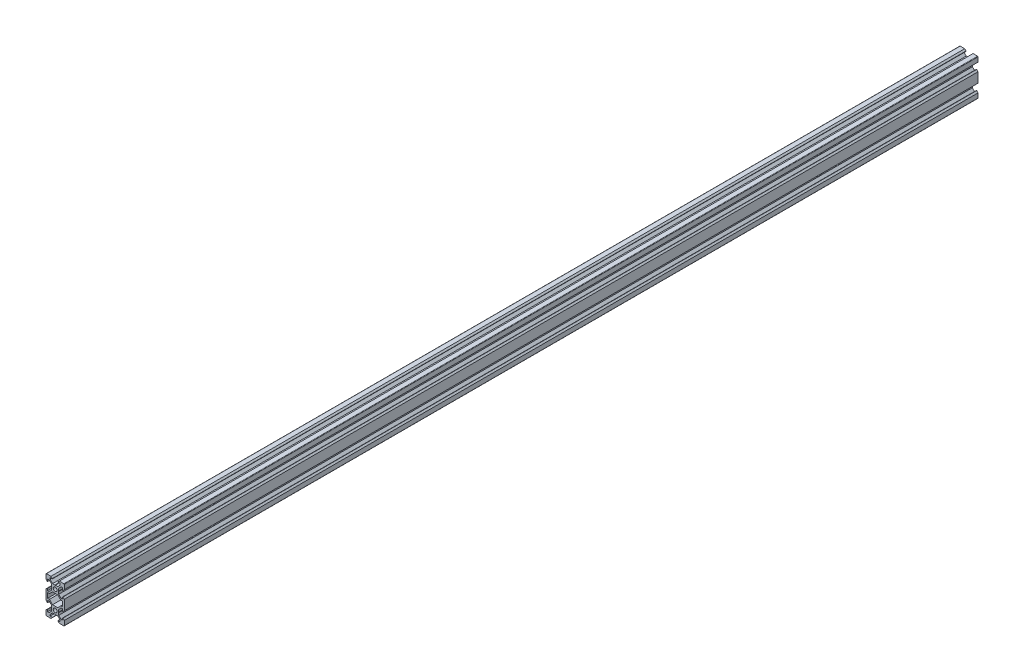
from build123d import *

# Parameters (mm, degrees)
SKETCH1_R            = 2.1
BOSS_EXTRUDE1_DEPTH  = 1000
M5_CLEARANCE_HOLE1_D = 5.5


with BuildPart() as part:
    # Sketch1 → Boss-Extrude1 (new body)
    with BuildSketch(Plane.XY):
        with BuildLine():
            Line((4.58, -20), (9.5, -20))
            ThreePointArc((9.5, -20), (9.853553391, -19.853553391), (10, -19.5))
            Line((10, -19.5), (10, -14.58))
            Line((10, -14.58), (8.545, -13.125))
            Line((8.545, -13.125), (8.2, -13.125))
            Line((8.2, -13.125), (8.2, -15.5))
            Line((8.2, -15.5), (6.560660172, -15.5))
            Line((6.560660172, -15.5), (3.9, -12.839339828))
            Line((3.9, -12.839339828), (3.9, -10.21))
            Line((3.9, -10.21), (3.69, -10))
            Line((3.69, -10), (3.9, -9.79))
            Line((3.9, -9.79), (3.9, -7.160660172))
            Line((3.9, -7.160660172), (6.560660172, -4.5))
            Line((6.560660172, -4.5), (8.2, -4.5))
            Line((8.2, -4.5), (8.2, -6.875))
            Line((8.2, -6.875), (8.545, -6.875))
            Line((8.545, -6.875), (10, -5.42))
            Line((10, -5.42), (10, 5.42))
            Line((10, 5.42), (8.545, 6.875))
            Line((8.545, 6.875), (8.2, 6.875))
            Line((8.2, 6.875), (8.2, 4.5))
            Line((8.2, 4.5), (6.560660172, 4.5))
            Line((6.560660172, 4.5), (3.9, 7.160660172))
            Line((3.9, 7.160660172), (3.9, 9.79))
            Line((3.9, 9.79), (3.69, 10))
            Line((3.69, 10), (3.9, 10.21))
            Line((3.9, 10.21), (3.9, 12.839339828))
            Line((3.9, 12.839339828), (6.560660172, 15.5))
            Line((6.560660172, 15.5), (8.2, 15.5))
            Line((8.2, 15.5), (8.2, 13.125))
            Line((8.2, 13.125), (8.545, 13.125))
            Line((8.545, 13.125), (10, 14.58))
            Line((10, 14.58), (10, 19.5))
            ThreePointArc((10, 19.5), (9.853553391, 19.853553391), (9.5, 20))
            Line((9.5, 20), (4.58, 20))
            Line((4.58, 20), (3.125, 18.545))
            Line((3.125, 18.545), (3.125, 18.2))
            Line((3.125, 18.2), (5.5, 18.2))
            Line((5.5, 18.2), (5.5, 16.560660172))
            Line((5.5, 16.560660172), (2.839339828, 13.9))
            Line((2.839339828, 13.9), (0.21, 13.9))
            Line((0.21, 13.9), (0, 13.69))
            Line((0, 13.69), (-0.21, 13.9))
            Line((-0.21, 13.9), (-2.839339828, 13.9))
            Line((-2.839339828, 13.9), (-5.5, 16.560660172))
            Line((-5.5, 16.560660172), (-5.5, 18.2))
            Line((-5.5, 18.2), (-3.125, 18.2))
            Line((-3.125, 18.2), (-3.125, 18.545))
            Line((-3.125, 18.545), (-4.58, 20))
            Line((-4.58, 20), (-9.5, 20))
            ThreePointArc((-9.5, 20), (-9.853553391, 19.853553391), (-10, 19.5))
            Line((-10, 19.5), (-10, 14.58))
            Line((-10, 14.58), (-8.545, 13.125))
            Line((-8.545, 13.125), (-8.2, 13.125))
            Line((-8.2, 13.125), (-8.2, 15.5))
            Line((-8.2, 15.5), (-6.560660172, 15.5))
            Line((-6.560660172, 15.5), (-3.9, 12.839339828))
            Line((-3.9, 12.839339828), (-3.9, 10.21))
            Line((-3.9, 10.21), (-3.69, 10))
            Line((-3.69, 10), (-3.9, 9.79))
            Line((-3.9, 9.79), (-3.9, 7.160660172))
            Line((-3.9, 7.160660172), (-6.560660172, 4.5))
            Line((-6.560660172, 4.5), (-8.2, 4.5))
            Line((-8.2, 4.5), (-8.2, 6.875))
            Line((-8.2, 6.875), (-8.545, 6.875))
            Line((-8.545, 6.875), (-10, 5.42))
            Line((-10, 5.42), (-10, -5.42))
            Line((-10, -5.42), (-8.545, -6.875))
            Line((-8.545, -6.875), (-8.2, -6.875))
            Line((-8.2, -6.875), (-8.2, -4.5))
            Line((-8.2, -4.5), (-6.560660172, -4.5))
            Line((-6.560660172, -4.5), (-3.9, -7.160660172))
            Line((-3.9, -7.160660172), (-3.9, -9.79))
            Line((-3.9, -9.79), (-3.69, -10))
            Line((-3.69, -10), (-3.9, -10.21))
            Line((-3.9, -10.21), (-3.9, -12.839339828))
            Line((-3.9, -12.839339828), (-6.560660172, -15.5))
            Line((-6.560660172, -15.5), (-8.2, -15.5))
            Line((-8.2, -15.5), (-8.2, -13.125))
            Line((-8.2, -13.125), (-8.545, -13.125))
            Line((-8.545, -13.125), (-10, -14.58))
            Line((-10, -14.58), (-10, -19.5))
            ThreePointArc((-10, -19.5), (-9.853553391, -19.853553391), (-9.5, -20))
            Line((-9.5, -20), (-4.58, -20))
            Line((-4.58, -20), (-3.125, -18.545))
            Line((-3.125, -18.545), (-3.125, -18.2))
            Line((-3.125, -18.2), (-5.5, -18.2))
            Line((-5.5, -18.2), (-5.5, -16.560660172))
            Line((-5.5, -16.560660172), (-2.839339828, -13.9))
            Line((-2.839339828, -13.9), (-0.21, -13.9))
            Line((-0.21, -13.9), (0, -13.69))
            Line((0, -13.69), (0.21, -13.9))
            Line((0.21, -13.9), (2.839339828, -13.9))
            Line((2.839339828, -13.9), (5.5, -16.560660172))
            Line((5.5, -16.560660172), (5.5, -18.2))
            Line((5.5, -18.2), (3.125, -18.2))
            Line((3.125, -18.2), (3.125, -18.545))
            Line((3.125, -18.545), (4.58, -20))
        make_face()
        with Locations((0, -10)):
            Circle(SKETCH1_R, mode=Mode.SUBTRACT)
        Polygon((-6.239339828, -2.7), (-8.2, -2.7), (-8.2, 2.7), (-6.239339828, 2.7), (-2.839339828, 6.1), (2.839339828, 6.1), (6.239339828, 2.7), (8.2, 2.7), (8.2, -2.7), (6.239339828, -2.7), (2.839339828, -6.1), (-2.839339828, -6.1), align=None, mode=Mode.SUBTRACT)
        with Locations((0, 10)):
            Circle(SKETCH1_R, mode=Mode.SUBTRACT)
    extrude(amount=BOSS_EXTRUDE1_DEPTH)

    # M5 Clearance Hole1 (through all)
    with Locations(Plane(origin=(10, -10, 168), x_dir=(0, 0, 1), z_dir=(1, 0, 0))):
        with Locations((0, 0), (0, -20), (-20, -20), (-20, 0)):
            m5_clearance_hole1 = Hole(M5_CLEARANCE_HOLE1_D / 2)

    # Mirror1: M5 Clearance Hole1 across plane
    add(m5_clearance_hole1.mirror(Plane.XY.offset(500)), mode=Mode.SUBTRACT)


solid = part.part
